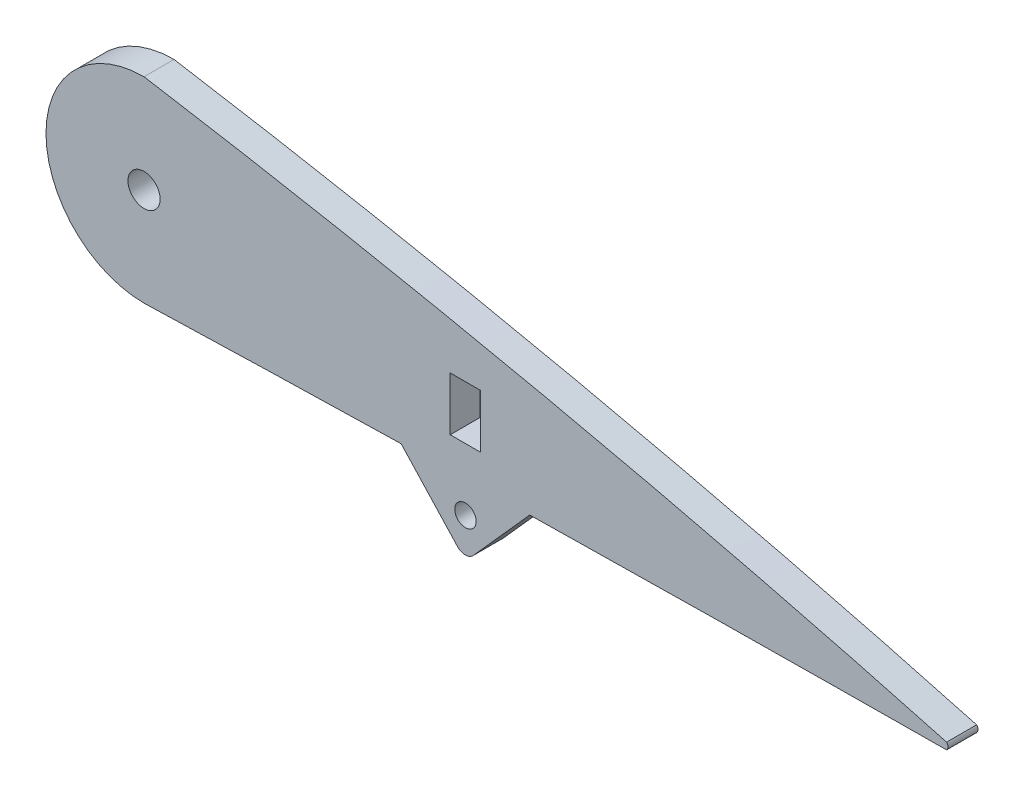
from build123d import *

# Parameters (mm, degrees)
SKETCH_1_R      = 1
SKETCH_1_R_2    = 1.5
SKETCH_1_W      = 2.85
SKETCH_1_H      = 5
EXTRUDE_1_DEPTH = 1.4


with BuildPart() as part:
    # Эскиз1 → Бобышка-Вытянуть1 (new, symmetric)
    with BuildSketch(Plane.XY):
        with BuildLine():
            ThreePointArc((175.091334091, 16.644787515), (168.620686799, 13.96455765), (165.940456932, 7.493910359))
            ThreePointArc((165.940456932, 7.493910359), (168.620686797, 1.023263065), (175.091334091, -1.656966802))
            add(Edge.make_bspline(
                [(175.091334091, -1.656966802), (177.330680613, -1.588466601), (181.854695323, -1.455127256), (188.663234462, -1.270383377), (194.423908611, -1.128102082), (197.899847219, -1.04871935), (199.091334091, -1.02226769)],
                knots=[0.704401069, 0.704401069, 0.704401069, 0.704401069, 0.730918775, 0.757971338, 0.785017763, 0.79912389, 0.79912389, 0.79912389, 0.79912389], degree=3))
            Line((199.091334091, -1.02226769), (204.343876183, -6.698358978))
            ThreePointArc((204.343876183, -6.698358978), (205.086913668, -7.019125459), (205.824005665, -6.684923086))
            Line((205.824005665, -6.684923086), (211.091334091, -0.78138581))
            add(Edge.make_bspline(
                [(211.091334091, -0.78138581), (215.029550732, -0.71061193), (221.226120504, -0.611852577), (229.617630172, -0.50292618), (236.087353854, -0.431514192), (241.980776913, -0.376520461), (246.558970011, -0.339535886), (249.120490965, -0.321271242), (250, -0.315)],
                knots=[0.846478182, 0.846478182, 0.846478182, 0.846478182, 0.893099152, 0.919831065, 0.945809917, 0.969680601, 0.989589706, 1, 1, 1, 1], degree=3))
            ThreePointArc((250, -0.315), (250.130477272, 0), (250, 0.315))
            add(Edge.make_bspline(
                [(250, 0.315), (249.15566774, 0.545019818), (246.720175698, 1.208516243), (242.391332083, 2.358339053), (236.849761204, 3.787625364), (230.779918279, 5.298008837), (224.455917947, 6.812866028), (218.030543496, 8.291610632), (211.562405045, 9.719735057), (205.072411509, 11.092374932), (198.567970913, 12.407850726), (192.052369914, 13.665297924), (185.527619973, 14.864093303), (179.872800983, 15.850364437), (176.392239334, 16.431323122), (175.091334091, 16.644787515)],
                knots=[0, 0, 0, 0, 0.0101622, 0.029313053, 0.052011605, 0.076619468, 0.101948061, 0.127526132, 0.153184131, 0.178867888, 0.204557903, 0.230245712, 0.255925967, 0.281594302, 0.296903142, 0.296903142, 0.296903142, 0.296903142], degree=3))
        make_face()
        with Locations((205.091334091, -3.806089643)):
            Circle(SKETCH_1_R, mode=Mode.SUBTRACT)
        with Locations((175.091334091, 7.493910357)):
            Circle(SKETCH_1_R_2, mode=Mode.SUBTRACT)
        with Locations((205.091334091, 4.493910357)):
            Rectangle(SKETCH_1_W, SKETCH_1_H, mode=Mode.SUBTRACT)
    extrude(amount=EXTRUDE_1_DEPTH, both=True)


solid = part.part
